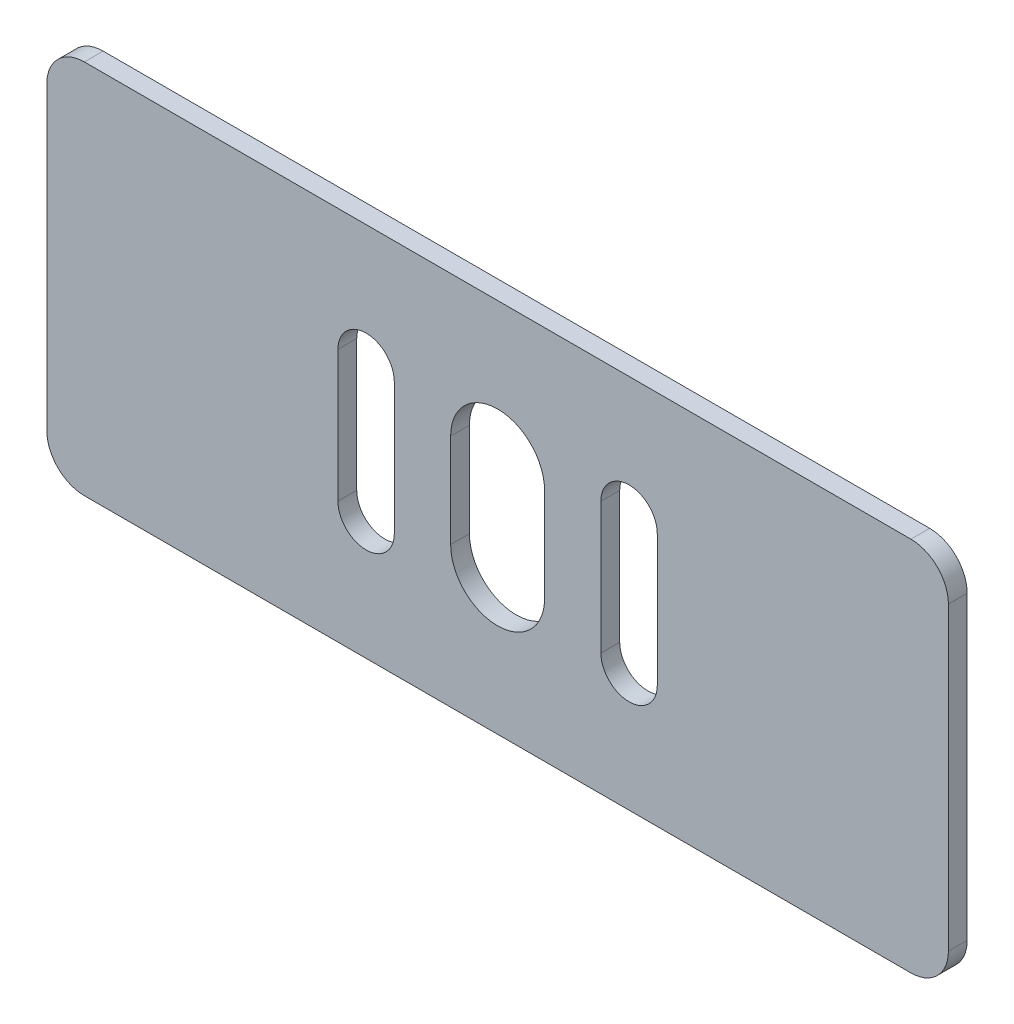
from build123d import *

# Parameters (mm, degrees)
BOSS_EXTRUDE1_DEPTH = 0.5


with BuildPart() as part:
    # Sketch1 → Boss-Extrude1 (new, symmetric)
    with BuildSketch(Plane.XY):
        with BuildLine():
            Line((22, -10), (-22, -10))
            ThreePointArc((-22, -10), (-23.414213562, -9.414213562), (-24, -8))
            Line((-24, -8), (-24, 8))
            ThreePointArc((-24, 8), (-23.414213562, 9.414213562), (-22, 10))
            Line((-22, 10), (22, 10))
            ThreePointArc((22, 10), (23.414213562, 9.414213562), (24, 8))
            Line((24, 8), (24, -8))
            ThreePointArc((24, -8), (23.414213562, -9.414213562), (22, -10))
        make_face()
        with BuildLine():
            Line((-2.5, -2.5), (-2.5, 2.5))
            ThreePointArc((-2.5, 2.5), (0, 5), (2.5, 2.5))
            Line((2.5, 2.5), (2.5, -2.5))
            ThreePointArc((2.5, -2.5), (0, -5), (-2.5, -2.5))
        make_face(mode=Mode.SUBTRACT)
        with BuildLine():
            Line((-8.5, -3.5), (-8.5, 3.5))
            ThreePointArc((-8.5, 3.5), (-7, 5), (-5.5, 3.5))
            Line((-5.5, 3.5), (-5.5, -3.5))
            ThreePointArc((-5.5, -3.5), (-7, -5), (-8.5, -3.5))
        make_face(mode=Mode.SUBTRACT)
        with BuildLine():
            Line((5.5, -3.5), (5.5, 3.5))
            ThreePointArc((5.5, 3.5), (7, 5), (8.5, 3.5))
            Line((8.5, 3.5), (8.5, -3.5))
            ThreePointArc((8.5, -3.5), (7, -5), (5.5, -3.5))
        make_face(mode=Mode.SUBTRACT)
    extrude(amount=BOSS_EXTRUDE1_DEPTH, both=True)


solid = part.part
